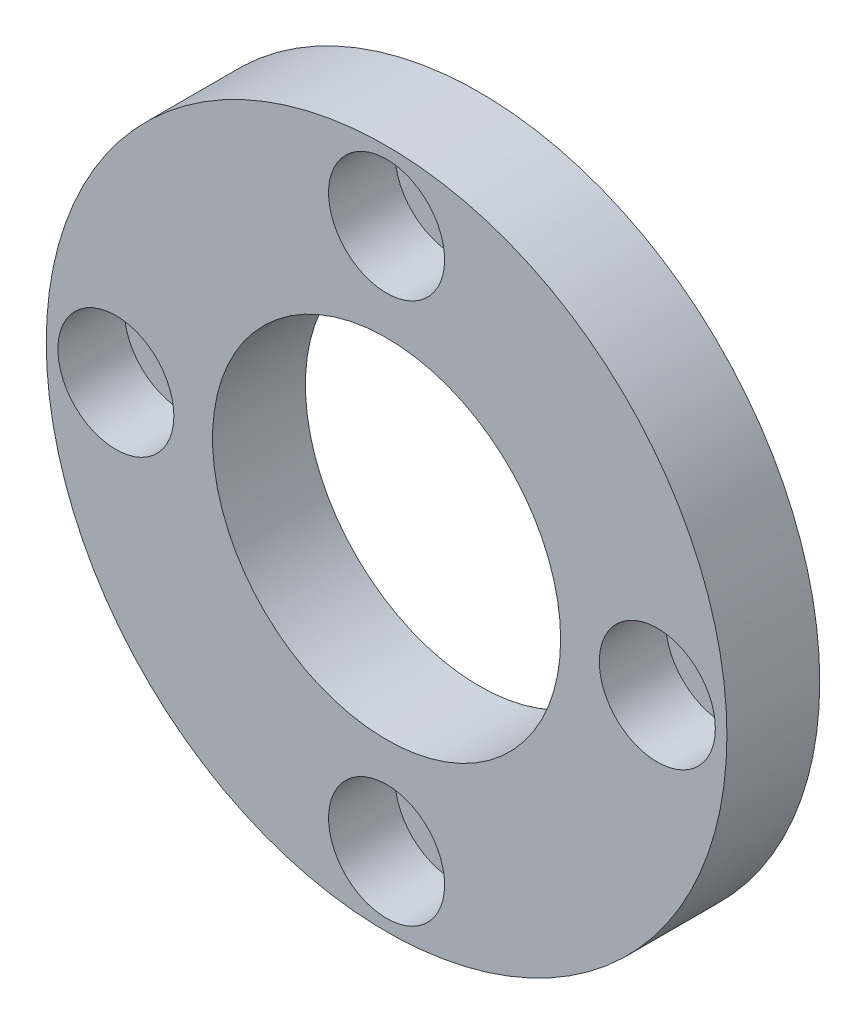
from build123d import *

# Parameters (mm, degrees)
IZIM1_R                                           = 44
IZIM1_R_2                                         = 22.5
Y_KSEKLIK_EKSTR_ZYON1_DEPTH                       = 12
M8_ALT_GEN_ALYAN_BA_L_K_R_VIDA_IN_HAV_D           = 9
M8_ALT_GEN_ALYAN_BA_L_K_R_VIDA_IN_HAV_DEPTH       = 22.25
M8_ALT_GEN_ALYAN_BA_L_K_R_VIDA_IN_HAV_CBORE_D     = 15
M8_ALT_GEN_ALYAN_BA_L_K_R_VIDA_IN_HAV_CBORE_DEPTH = 8.6
M8_ALT_GEN_ALYAN_BA_L_K_R_VIDA_IN_HAV_TIP         = 2.703872786


with BuildPart() as part:
    # Çizim1 → Yükseklik-Ekstrüzyon1 (new body)
    with BuildSketch(Plane.XY):
        Circle(IZIM1_R)
        Circle(IZIM1_R_2, mode=Mode.SUBTRACT)
    extrude(amount=Y_KSEKLIK_EKSTR_ZYON1_DEPTH)

    # M8 Altıgen Alyan Başlı Kör Vida İçin Havşa1
    with Locations(Plane.XY.offset(12)):
        with Locations((0, -35), (-35, 0), (0, 35), (35, 0)):
            CounterBoreHole(M8_ALT_GEN_ALYAN_BA_L_K_R_VIDA_IN_HAV_D / 2, M8_ALT_GEN_ALYAN_BA_L_K_R_VIDA_IN_HAV_CBORE_D / 2, M8_ALT_GEN_ALYAN_BA_L_K_R_VIDA_IN_HAV_CBORE_DEPTH, depth=M8_ALT_GEN_ALYAN_BA_L_K_R_VIDA_IN_HAV_DEPTH)
            with Locations((0, 0, -(M8_ALT_GEN_ALYAN_BA_L_K_R_VIDA_IN_HAV_DEPTH + M8_ALT_GEN_ALYAN_BA_L_K_R_VIDA_IN_HAV_TIP / 2))):  # 118° drill point
                Cone(0, M8_ALT_GEN_ALYAN_BA_L_K_R_VIDA_IN_HAV_D / 2, M8_ALT_GEN_ALYAN_BA_L_K_R_VIDA_IN_HAV_TIP, mode=Mode.SUBTRACT)


solid = part.part
